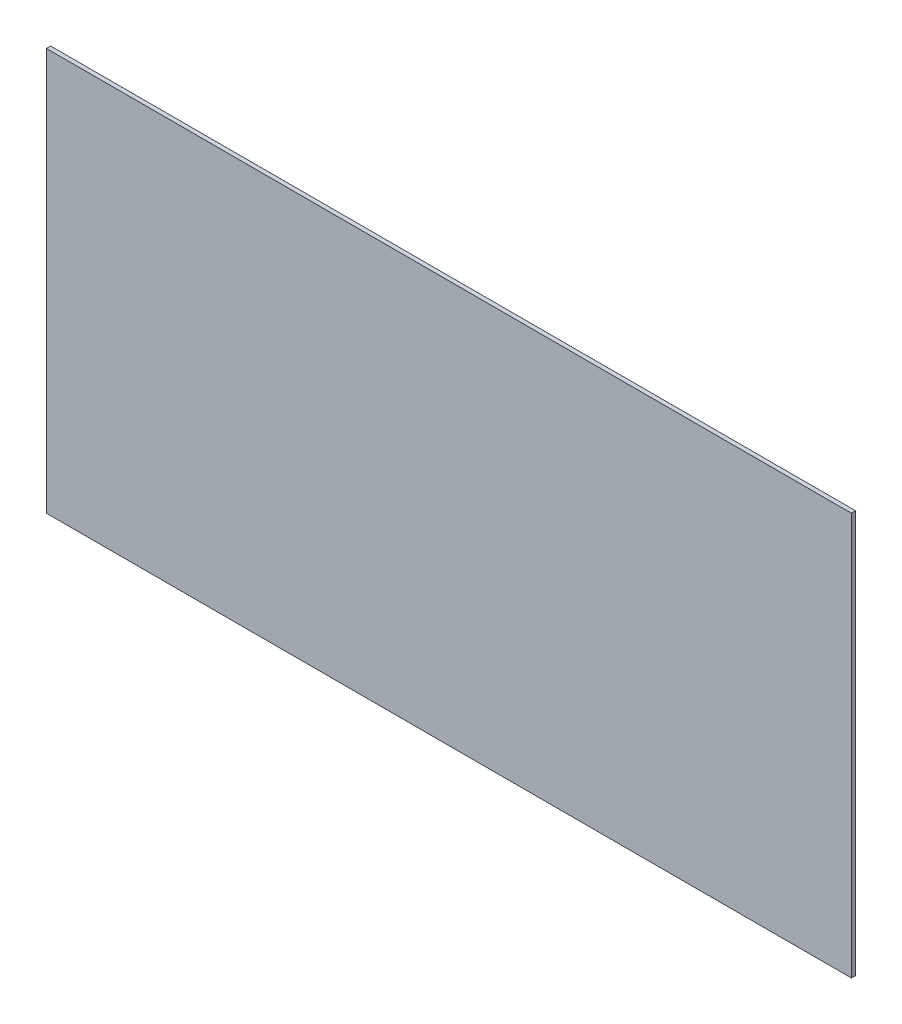
from build123d import *

# Parameters (mm, degrees)
SKETCH1_W           = 1219.2
SKETCH1_H           = 609.6
BOSS_EXTRUDE1_DEPTH = 6.35


with BuildPart() as part:
    # Sketch1 → Boss-Extrude1 (new body)
    with BuildSketch(Plane.XY):
        with Locations((609.6, 304.8)):
            Rectangle(SKETCH1_W, SKETCH1_H)
    extrude(amount=BOSS_EXTRUDE1_DEPTH)


solid = part.part
